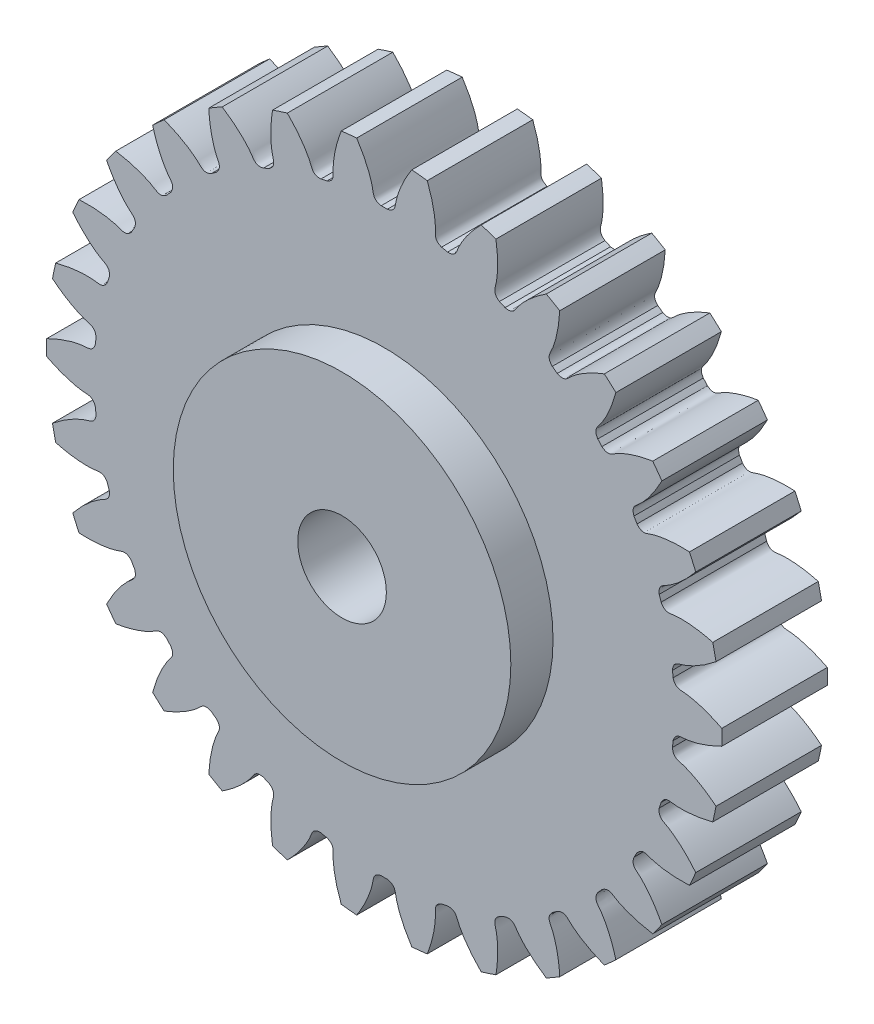
from build123d import *

# Parameters (mm, degrees)
SKETCH_1_R               = 8
EXTRUDE_1_DEPTH          = 2.5
CUT_EXTRUDE_1_DEPTH      = 12.586630226
PATTERN_CIRCULAR_1_COUNT = 30
SKETCH_5_R               = 4
EXTRUDE_2_DEPTH          = 1
EXTRUDE_START            = 1
SKETCH_6_R               = 4
EXTRUDE_3_DEPTH          = 1
CUT_EXTRUDE_2_REACH      = 17.325
CUT_EXTRUDE_START        = -3.5


with BuildPart() as part:
    # 草图1 → 凸台-拉伸1 (new body)
    with BuildSketch(Plane.XY):
        Circle(SKETCH_1_R)
    extrude(amount=EXTRUDE_1_DEPTH)

    # 草图2 → 切除-拉伸1 (cut, through all)
    with BuildSketch(Plane.XY):
        with BuildLine():
            ThreePointArc((0.072779314, 6.874614765), (0, 6.875), (-0.072779314, 6.874614765))
            add(Edge.make_bspline(
                [(-0.072779314, 6.874614765), (-0.254115345, 6.906487585), (-0.255152373, 7.023566318), (-0.27949241, 7.144289508), (-0.284975371, 7.169064619), (-0.291623543, 7.196462455), (-0.299533859, 7.226448996), (-0.308815312, 7.258982454), (-0.319571679, 7.294019257), (-0.331906756, 7.331512239), (-0.345922647, 7.37141123), (-0.361720171, 7.413662928), (-0.379398634, 7.458210975), (-0.399055788, 7.504995991), (-0.420787741, 7.553955613), (-0.444688876, 7.605024538), (-0.470851774, 7.658134564), (-0.499367135, 7.713214643), (-0.530323704, 7.770190925), (-0.563808189, 7.828986808), (-0.599905197, 7.889522992), (-0.638697148, 7.951717532), (-0.680264215, 8.015485894), (-0.724684248, 8.080741014), (-0.772032703, 8.147393354), (-0.822382582, 8.215350967), (-0.875804359, 8.284519558), (-0.932365919, 8.354802549), (-0.992132498, 8.426101145), (-1.055166616, 8.498314402), (-1.121528021, 8.571339295), (-1.191273632, 8.645070792), (-1.264457479, 8.719401924), (-1.341130655, 8.794223857), (-1.421341241, 8.869425973), (-1.534461933, 8.971310414), (-1.622672309, 9.046035766), (-1.683155916, 9.095279061)],
                knots=[0, 0, 0, 0, 0.115323882, 0.12341257, 0.132512303, 0.142623081, 0.153744905, 0.165877774, 0.179021689, 0.193176649, 0.208342655, 0.224519706, 0.241707802, 0.259906945, 0.279117132, 0.299338365, 0.320570644, 0.342813968, 0.366068337, 0.390333752, 0.415610213, 0.441897719, 0.46919627, 0.497505867, 0.52682651, 0.557158198, 0.588500931, 0.62085471, 0.654219534, 0.688595404, 0.723982319, 0.76038028, 0.797789286, 0.836209338, 0.875640435, 0.916082578, 1, 1, 1, 1], degree=3))
            ThreePointArc((-1.683155916, 9.095279061), (0, 9.249708917), (1.683155916, 9.095279061))
            add(Edge.make_bspline(
                [(0.072779314, 6.874614765), (0.254115345, 6.906487585), (0.255152373, 7.023566318), (0.27949241, 7.144289508), (0.284975371, 7.169064619), (0.291623543, 7.196462455), (0.299533859, 7.226448996), (0.308815312, 7.258982454), (0.319571679, 7.294019257), (0.331906756, 7.331512239), (0.345922647, 7.37141123), (0.361720171, 7.413662928), (0.379398634, 7.458210975), (0.399055788, 7.504995991), (0.420787741, 7.553955613), (0.444688876, 7.605024538), (0.470851774, 7.658134564), (0.499367135, 7.713214643), (0.530323704, 7.770190925), (0.563808189, 7.828986808), (0.599905197, 7.889522992), (0.638697148, 7.951717532), (0.680264215, 8.015485894), (0.724684248, 8.080741014), (0.772032703, 8.147393354), (0.822382582, 8.215350967), (0.875804359, 8.284519558), (0.932365919, 8.354802549), (0.992132498, 8.426101145), (1.055166616, 8.498314402), (1.121528021, 8.571339295), (1.191273632, 8.645070792), (1.264457479, 8.719401924), (1.341130655, 8.794223857), (1.421341241, 8.869425973), (1.534461933, 8.971310414), (1.622672309, 9.046035766), (1.683155916, 9.095279061)],
                knots=[0, 0, 0, 0, 0.115323882, 0.12341257, 0.132512303, 0.142623081, 0.153744905, 0.165877774, 0.179021689, 0.193176649, 0.208342655, 0.224519706, 0.241707802, 0.259906945, 0.279117132, 0.299338365, 0.320570644, 0.342813968, 0.366068337, 0.390333752, 0.415610213, 0.441897719, 0.46919627, 0.497505867, 0.52682651, 0.557158198, 0.588500931, 0.62085471, 0.654219534, 0.688595404, 0.723982319, 0.76038028, 0.797789286, 0.836209338, 0.875640435, 0.916082578, 1, 1, 1, 1], degree=3))
        make_face()
    cut_extrude_1 = extrude(amount=CUT_EXTRUDE_1_DEPTH, mode=Mode.SUBTRACT)

    # 阵列(圆周)1: 切除-拉伸1 ×30 about axis
    pattern_circular_1_axis = Axis((0, 0, -0.15), (0, 0, 1))
    for i in range(1, PATTERN_CIRCULAR_1_COUNT):
        add(cut_extrude_1.rotate(pattern_circular_1_axis, i * 360 / PATTERN_CIRCULAR_1_COUNT), mode=Mode.SUBTRACT)

    # 草图5 → 凸台-拉伸2 (add)
    with BuildSketch(Plane(origin=(0, 0, 0), x_dir=(-1, 0, 0), z_dir=(0, 0, -1))):
        Circle(SKETCH_5_R)
    extrude(amount=EXTRUDE_2_DEPTH)

    # 草图6 → 凸台-拉伸3 (add)
    with BuildSketch(Plane.XY.offset(2.5).offset(EXTRUDE_START)):
        Circle(SKETCH_6_R)
    extrude(amount=-EXTRUDE_3_DEPTH)

    # 草图4 → 切除-拉伸2 (cut, up to next)
    with BuildSketch(Plane(origin=(0, 0, 0), x_dir=(-1, 0, 0), z_dir=(0, 0, -1)).offset(CUT_EXTRUDE_START), mode=Mode.PRIVATE) as cut_extrude_2_sk1:
        with BuildLine():
            ThreePointArc((-0.525, 0.909326674), (0, -1.05), (0.525, 0.909326674))
            ThreePointArc((0.525, 0.909326674), (0, 1.05), (-0.525, 0.909326674))
        make_face()
    cut_extrude_2_tool1 = extrude(cut_extrude_2_sk1.sketch, amount=CUT_EXTRUDE_2_REACH, mode=Mode.PRIVATE) & part.part
    add(cut_extrude_2_tool1.solids().sort_by_distance((0, 0, 3.5))[0], mode=Mode.SUBTRACT)


solid = part.part
